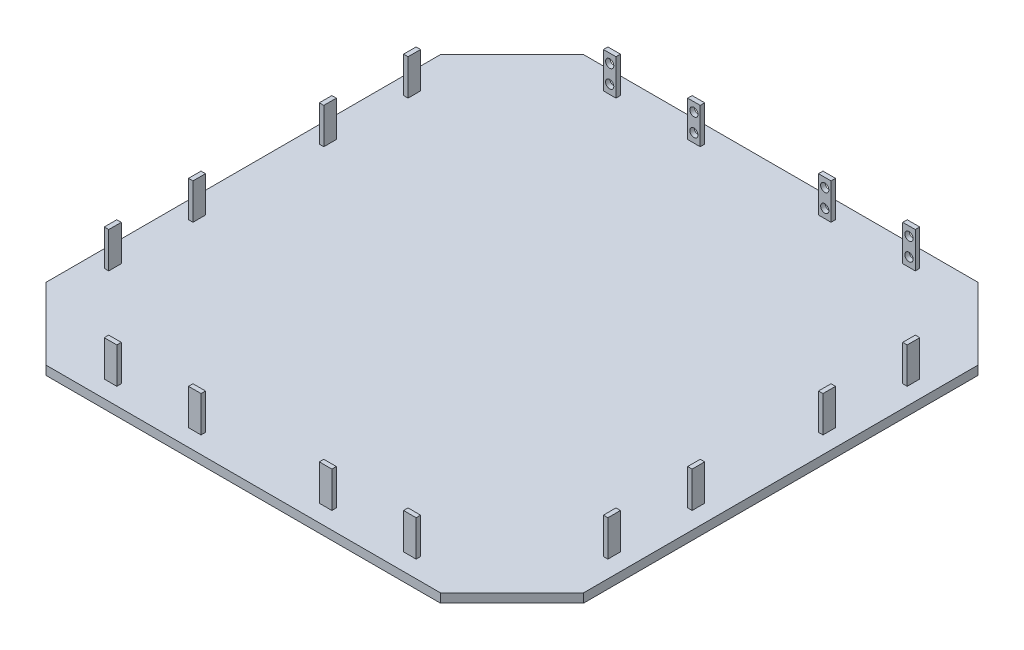
from build123d import *

# Parameters (mm, degrees)
EXTRUDE_1_DEPTH     = 5
SKETCH_1_5_W        = 7
SKETCH_1_5_H        = 2.5
SKETCH_1_5_W_2      = 2.5
SKETCH_1_5_H_2      = 7
EXTRUDE_2_DEPTH     = 25
SKETCH_15_R         = 2.3
CUT_EXTRUDE_1_DEPTH = 20


with BuildPart() as part:
    # 草图1 → 凸台-拉伸1 (new body)
    with BuildSketch(Plane(origin=(0, 0, 0), x_dir=(1, 0, 0), z_dir=(0, 1, 0))):
        Polygon((-110, 150), (-150, 110), (-150, -110), (-110, -150), (110, -150), (150, -110), (150, 110), (110, 150), align=None)
    extrude(amount=EXTRUDE_1_DEPTH)

    # 草图1<5> → 凸台-拉伸2 (add)
    with BuildSketch(Plane(origin=(0, 0, 0), x_dir=(1, 0, 0), z_dir=(0, 1, 0))):
        with Locations((-83.5, 139.25)):
            Rectangle(SKETCH_1_5_W, SKETCH_1_5_H)
        with Locations((-139.25, 83.5)):
            Rectangle(SKETCH_1_5_W_2, SKETCH_1_5_H_2)
        with Locations((-36.5, 139.25)):
            Rectangle(SKETCH_1_5_W, SKETCH_1_5_H)
        with Locations((-139.25, 36.5)):
            Rectangle(SKETCH_1_5_W_2, SKETCH_1_5_H_2)
        with Locations((36.5, 139.25)):
            Rectangle(SKETCH_1_5_W, SKETCH_1_5_H)
        with Locations((-139.25, -36.5)):
            Rectangle(SKETCH_1_5_W_2, SKETCH_1_5_H_2)
        with Locations((83.5, 139.25)):
            Rectangle(SKETCH_1_5_W, SKETCH_1_5_H)
        with Locations((-139.25, -83.5)):
            Rectangle(SKETCH_1_5_W_2, SKETCH_1_5_H_2)
        with Locations((139.25, 83.5)):
            Rectangle(SKETCH_1_5_W_2, SKETCH_1_5_H_2)
        with Locations((-83.5, -139.25)):
            Rectangle(SKETCH_1_5_W, SKETCH_1_5_H)
        with Locations((139.25, 36.5)):
            Rectangle(SKETCH_1_5_W_2, SKETCH_1_5_H_2)
        with Locations((-36.5, -139.25)):
            Rectangle(SKETCH_1_5_W, SKETCH_1_5_H)
        with Locations((139.25, -36.5)):
            Rectangle(SKETCH_1_5_W_2, SKETCH_1_5_H_2)
        with Locations((36.5, -139.25)):
            Rectangle(SKETCH_1_5_W, SKETCH_1_5_H)
        with Locations((139.25, -83.5)):
            Rectangle(SKETCH_1_5_W_2, SKETCH_1_5_H_2)
        with Locations((83.5, -139.25)):
            Rectangle(SKETCH_1_5_W, SKETCH_1_5_H)
    extrude(amount=EXTRUDE_2_DEPTH)

    # 草图15 → 切除-拉伸1 (cut)
    with BuildSketch(Plane(origin=(0, 0, -140.5), x_dir=(-1, 0, 0), z_dir=(0, 0, -1))):
        with Locations((-83.5, 20)):
            Circle(SKETCH_15_R)
        with Locations((-83.5, 10)):
            Circle(SKETCH_15_R)
        with Locations((-36.5, 20)):
            Circle(SKETCH_15_R)
        with Locations((-36.5, 10)):
            Circle(SKETCH_15_R)
        with Locations((36.5, 10)):
            Circle(SKETCH_15_R)
        with Locations((36.5, 20)):
            Circle(SKETCH_15_R)
        with Locations((83.5, 20)):
            Circle(SKETCH_15_R)
        with Locations((83.5, 10)):
            Circle(SKETCH_15_R)
    extrude(amount=-CUT_EXTRUDE_1_DEPTH, mode=Mode.SUBTRACT)


solid = part.part
